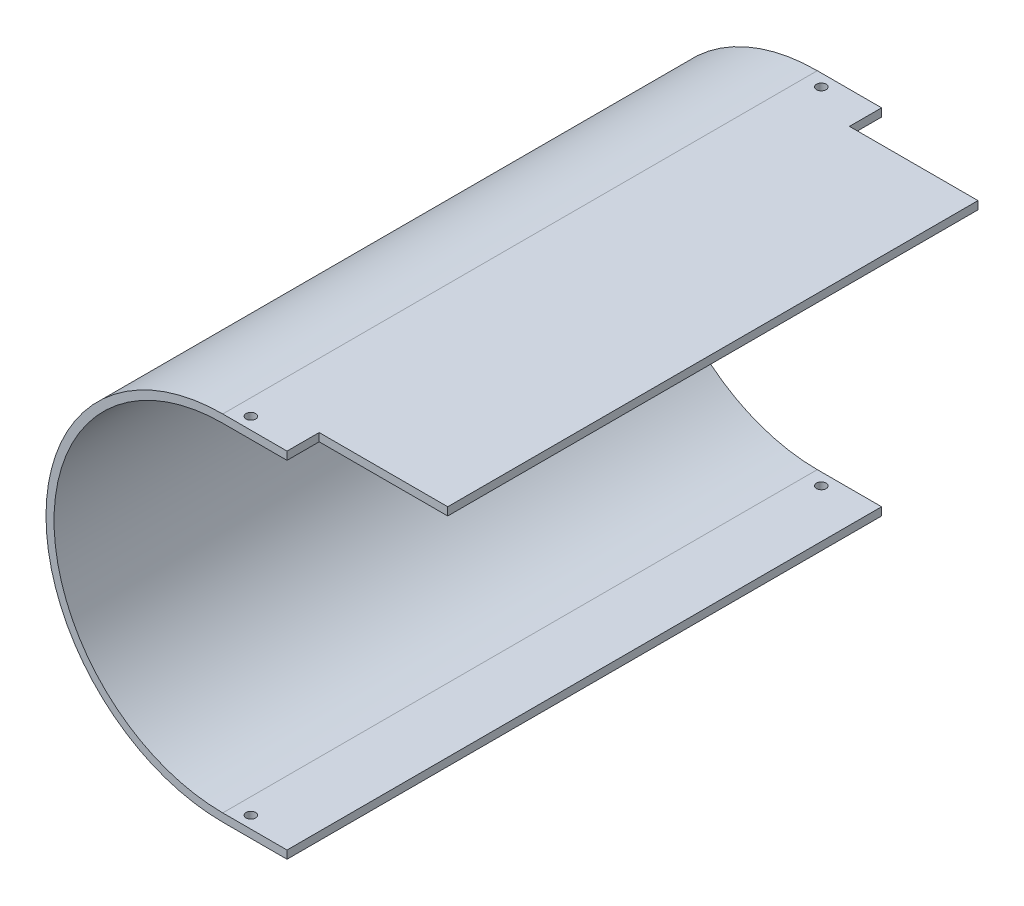
from build123d import *

# Parameters (mm, degrees)
BOSS_EXTRUDE1_DEPTH     = 92.5
CUT_EXTRUDE2_DEPTH      = 158.5
CUT_EXTRUDE2_DEPTH_BACK = 158.5
SKETCH3_R               = 1.5
SKETCH4_W               = 40
SKETCH4_H               = 165
BOSS_EXTRUDE2_DEPTH     = 2.5


with BuildPart() as part:
    # Sketch1 → Boss-Extrude1 (new, symmetric)
    with BuildSketch(Plane.XY):
        with BuildLine():
            Line((-40, 55), (-60, 55))
            ThreePointArc((-60, 55), (-115, 0), (-60, -55))
            Line((-60, -55), (-40, -55))
            Line((-40, -55), (-40, -52.5))
            Line((-40, -52.5), (-60, -52.5))
            ThreePointArc((-60, -52.5), (-112.5, 0), (-60, 52.5))
            Line((-60, 52.5), (-40, 52.5))
            Line((-40, 52.5), (-40, 55))
        make_face()
    extrude(amount=BOSS_EXTRUDE1_DEPTH, both=True)

    # Sketch3 → Cut-Extrude2 (cut, two sides: drawn at the far end of the back side and taken through both)
    with BuildSketch(Plane(origin=(0, 0, 0), x_dir=(1, 0, 0), z_dir=(0, 1, 0)).offset(-CUT_EXTRUDE2_DEPTH_BACK)):
        with Locations(Location((-55, 88.75, 0), (0, 0, 270))):
            Circle(SKETCH3_R)
        with Locations((-33, 88.75)):
            Circle(SKETCH3_R)
        with Locations((-11, 88.75)):
            Circle(SKETCH3_R)
        with Locations((-11, -88.75)):
            Circle(SKETCH3_R)
        with Locations((-33, -88.75)):
            Circle(SKETCH3_R)
        with Locations(Location((-55, -88.75, 0), (0, 0, 270))):
            Circle(SKETCH3_R)
    extrude(amount=CUT_EXTRUDE2_DEPTH + CUT_EXTRUDE2_DEPTH_BACK, mode=Mode.SUBTRACT)

    # Sketch4 → Boss-Extrude2 (add)
    with BuildSketch(Plane(origin=(0, 55, 0), x_dir=(1, 0, 0), z_dir=(0, 1, 0))):
        with Locations((-20, 0)):
            Rectangle(SKETCH4_W, SKETCH4_H)
    extrude(amount=-BOSS_EXTRUDE2_DEPTH)


solid = part.part
